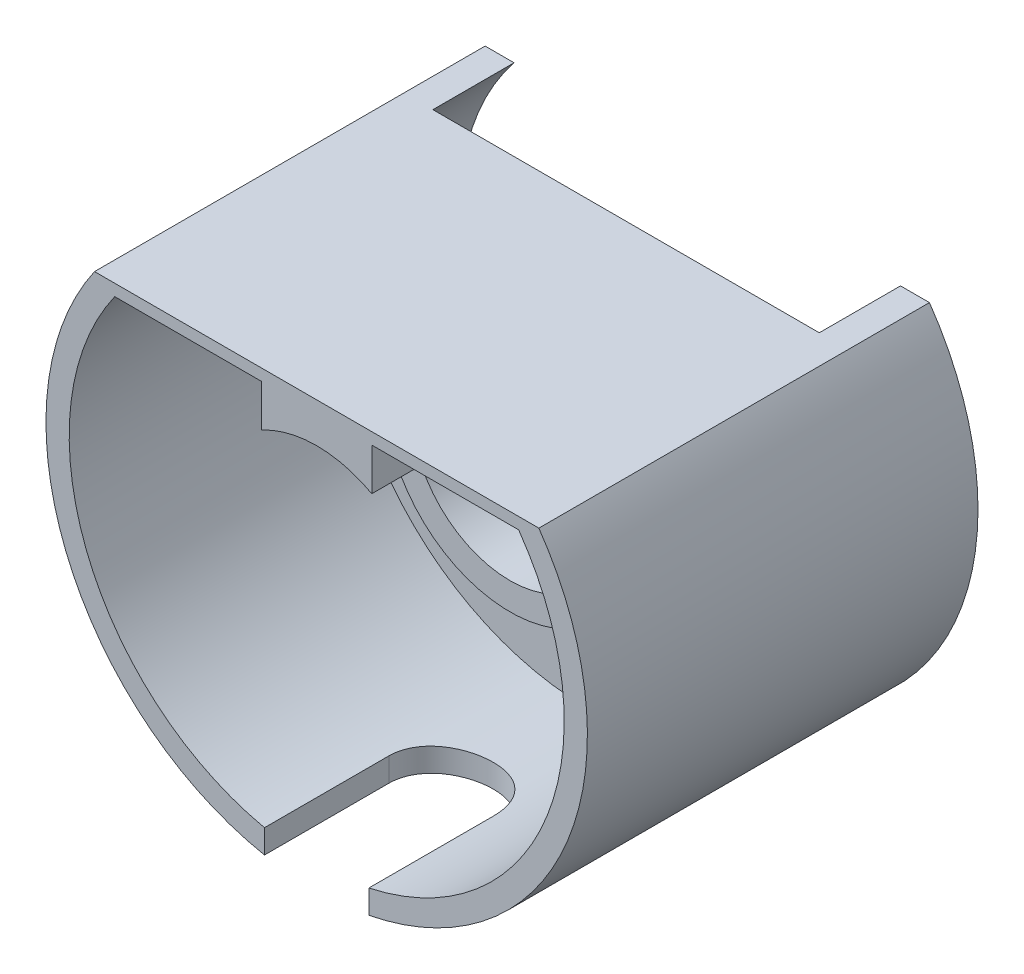
from build123d import *

# Parameters (mm, degrees)
BOSS_EXTRUDE1_DEPTH = 21
BOSS_EXTRUDE2_DEPTH = 10
SKETCH1_30_R        = 32.5
SKETCH1_30_R_2      = 25.5
SKETCH1_30_R_3      = 4
BOSS_EXTRUDE3_DEPTH = 30
BOSS_EXTRUDE5_DEPTH = 40
BOSS_EXTRUDE6_DEPTH = 80
BOSS_EXTRUDE7_START = 80
BOSS_EXTRUDE7_DEPTH = 80
CUT_EXTRUDE2_DEPTH  = 99


with BuildPart() as part:
    # Sketch1 → Boss-Extrude1 (new body)
    with BuildSketch(Plane.XY):
        with BuildLine():
            ThreePointArc((89.959983987, 3), (91.112349849, 1.51658984), (92.220685557, 0))
            ThreePointArc((92.220685557, 0), (100.984112175, -17.585107206), (104, -37))
            ThreePointArc((104, -37), (20.585107206, -97.984112175), (-12.220685557, 0))
            ThreePointArc((-12.220685557, 0), (-11.112349849, 1.51658984), (-9.959983987, 3))
            Line((-9.959983987, 3), (-17.445626465, 3))
            ThreePointArc((-17.445626465, 3), (19.038056538, -103.787700412), (110, -37))
            ThreePointArc((110, -37), (106.787700412, -16.038056538), (97.445626465, 3))
            Line((97.445626465, 3), (89.959983987, 3))
        make_face()
    extrude(amount=-BOSS_EXTRUDE1_DEPTH)



with BuildPart() as body_2:
    # Sketch1<29> → Boss-Extrude2 (new body)
    with BuildSketch(Plane.XY):
        with BuildLine():
            Line((89.959983987, 3), (-9.959983987, 3))
            ThreePointArc((-9.959983987, 3), (40, -101), (89.959983987, 3))
        make_face()
    extrude(amount=BOSS_EXTRUDE2_DEPTH)

    # Sketch1<30> → Boss-Extrude3 (add)
    # profile 1 of 2: a face of its own
    with BuildSketch(Plane.XY):
        with Locations((40, -37)):
            Circle(SKETCH1_30_R)
        with Locations((40, -37)):
            Circle(SKETCH1_30_R_2, mode=Mode.SUBTRACT)
    # profile 2 of 2: a face of its own
    with BuildSketch(Plane.XY):
        with Locations((40, -20.887152182)):
            Circle(SKETCH1_30_R_3)
    extrude(amount=BOSS_EXTRUDE3_DEPTH)

    # Sketch1<33> → Boss-Extrude5 (add)
    with BuildSketch(Plane.XY):
        with BuildLine():
            Line((80, -44), (80, -30))
            Line((80, -30), (68.9, -30))
            ThreePointArc((68.9, -30), (69.735668817, -37), (68.9, -44))
            Line((68.9, -44), (80, -44))
        make_face()
        with BuildLine():
            Line((0, -44), (11.1, -44))
            ThreePointArc((11.1, -44), (10.264331183, -37), (11.1, -30))
            Line((11.1, -30), (0, -30))
            Line((0, -30), (0, -44))
        make_face()
    extrude(amount=BOSS_EXTRUDE5_DEPTH)

    # Sketch1<34> → Boss-Extrude6 (add)
    with BuildSketch(Plane.XY):
        with BuildLine():
            Line((54.25, 0), (25.75, 0))
            Line((25.75, 0), (25.75, -10.901197345))
            ThreePointArc((25.75, -10.901197345), (40, -7.264331183), (54.25, -10.901197345))
            Line((54.25, -10.901197345), (54.25, 0))
        make_face()
    extrude(amount=BOSS_EXTRUDE6_DEPTH)


with BuildPart() as part_1:
    add(part.part)

    add(body_2.part)  # Boss-Extrude7 merges body 2
    # Sketch1<35> → Boss-Extrude7 (add)
    with BuildSketch(Plane.XY.offset(BOSS_EXTRUDE7_START)):
        with BuildLine():
            ThreePointArc((-17.445626465, 3), (40, -107), (97.445626465, 3))
            Line((97.445626465, 3), (-17.445626465, 3))
        make_face()
        with BuildLine():
            ThreePointArc((92.220685557, 0), (40, -101), (-12.220685557, 0))
            Line((-12.220685557, 0), (92.220685557, 0))
        make_face(mode=Mode.SUBTRACT)
    extrude(amount=-BOSS_EXTRUDE7_DEPTH)

    # Sketch4 → Cut-Extrude2 (cut)
    with BuildSketch(Plane(origin=(0, -60, 0), x_dir=(-1, 0, 0), z_dir=(0, -1, 0))):
        with BuildLine():
            Line((-53.5, -80), (-53.5, -47.833564603))
            ThreePointArc((-53.5, -47.833564603), (-40, -34.333564603), (-26.5, -47.833564603))
            Line((-26.5, -47.833564603), (-26.5, -80))
            ThreePointArc((-26.5, -80), (-40, -93.5), (-53.5, -80))
        make_face()
    extrude(amount=CUT_EXTRUDE2_DEPTH, mode=Mode.SUBTRACT)


solid = part_1.part
